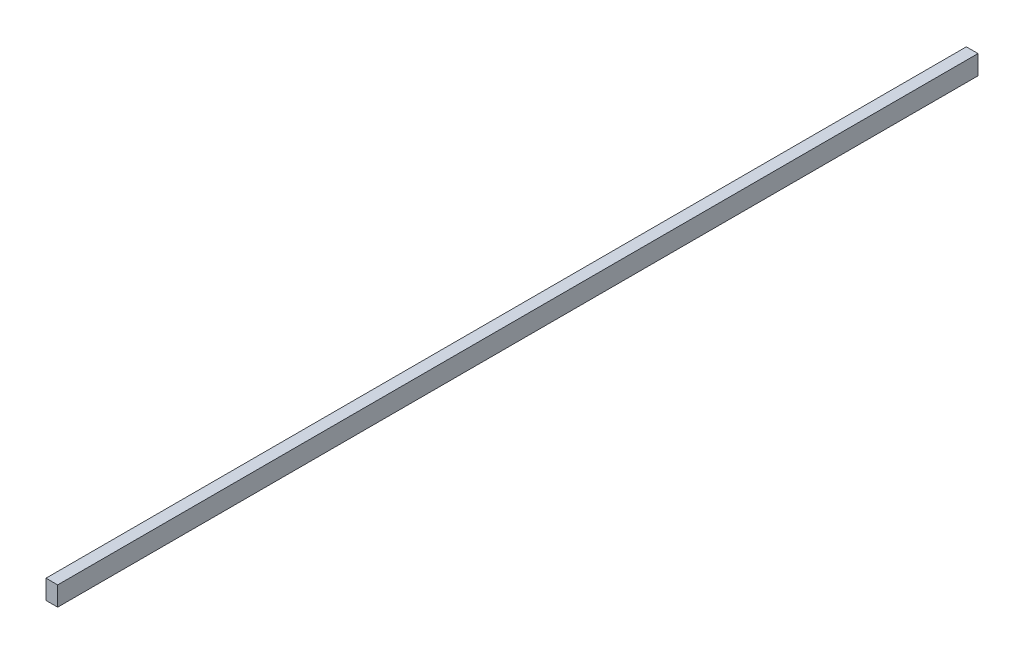
from build123d import *

# Parameters (mm, degrees)
ESQUISSE1_W        = 38
ESQUISSE1_H        = 63
BOSS_EXTRU_1_DEPTH = 3000


with BuildPart() as part:
    # Esquisse1 → Boss.-Extru.1 (new body)
    with BuildSketch(Plane.XY):
        with Locations((19, 31.5)):
            Rectangle(ESQUISSE1_W, ESQUISSE1_H)
    extrude(amount=BOSS_EXTRU_1_DEPTH)


solid = part.part
